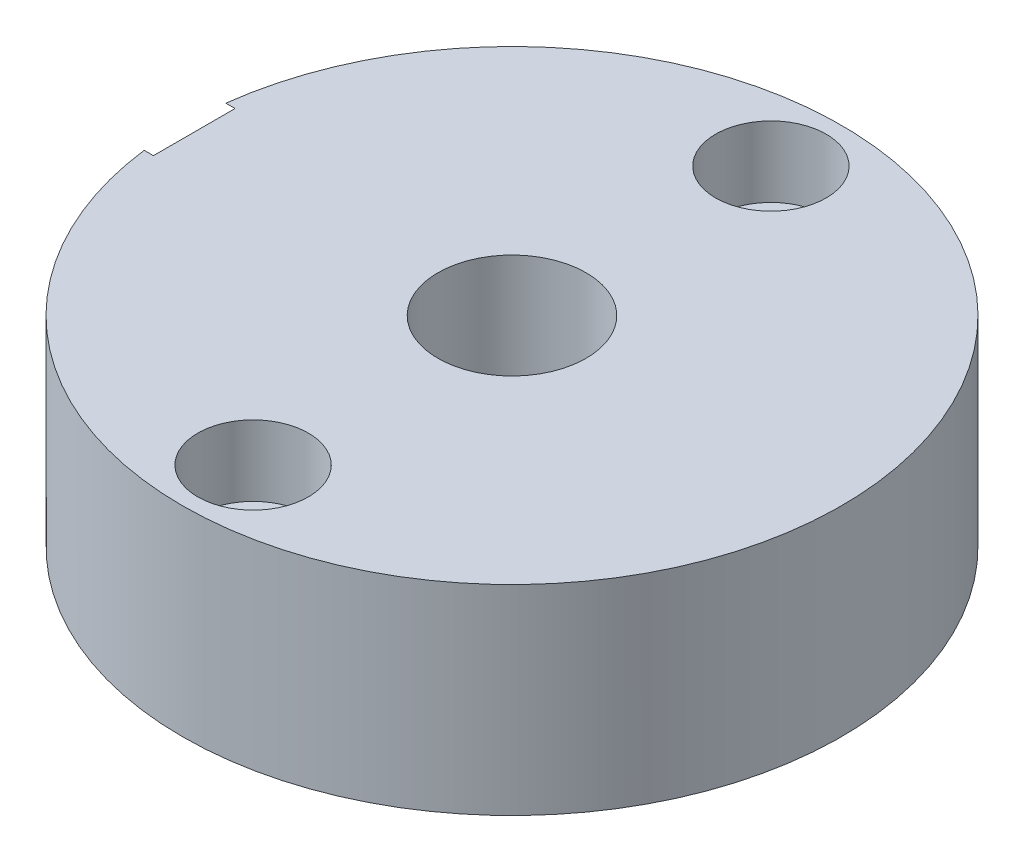
from build123d import *

# Parameters (mm, degrees)
SKETCH1_W                                          = 14.224
SKETCH1_H                                          = 8.636
CBORE_FOR_M2_5_HEX_HEAD_MACHINE_SCREW1_D           = 3.048
CBORE_FOR_M2_5_HEX_HEAD_MACHINE_SCREW1_CBORE_D     = 4.7752
CBORE_FOR_M2_5_HEX_HEAD_MACHINE_SCREW1_CBORE_DEPTH = 3.048
M2_5_CLEARANCE_HOLE1_D                             = 3.048
M2_5_CLEARANCE_HOLE1_DEPTH                         = 2.54
CBORE_FOR_M6_HEX_HEAD_BOLT1_D                      = 6.4008
CBORE_FOR_M6_HEX_HEAD_BOLT1_CBORE_D                = 15.494
CBORE_FOR_M6_HEX_HEAD_BOLT1_CBORE_DEPTH            = 2.54
CBORE_FOR_M3_5_HEX_HEAD_MACHINE_SCREW1_D           = 3.96748
CBORE_FOR_M3_5_HEX_HEAD_MACHINE_SCREW1_DEPTH       = 7.112
CBORE_FOR_M3_5_HEX_HEAD_MACHINE_SCREW1_CBORE_D     = 7.9375
CBORE_FOR_M3_5_HEX_HEAD_MACHINE_SCREW1_CBORE_DEPTH = 0.508
CBORE_FOR_M3_5_HEX_HEAD_MACHINE_SCREW1_TIP         = 1.145312823
CHAMFER1_SIZE                                      = 0.42926


with BuildPart() as part:
    # Sketch1 → Revolve1 (revolve)
    with BuildSketch(Plane(origin=(0, 0, 0), x_dir=(-1, 0, 0), z_dir=(0, 0, -1)), mode=Mode.PRIVATE) as revolve1_sk:
        with Locations((-7.112, 4.318)):
            Rectangle(SKETCH1_W, SKETCH1_H)
    revolve(revolve1_sk.sketch.rotate(Axis((0, 0, 0), (0, 1, 0)), 270), axis=Axis((0, 0, 0), (0, 1, 0)))

    # CBORE for M2.5 Hex Head Machine Screw1 (through all)
    with Locations(Plane(origin=(0, 8.636, 0), x_dir=(1, 0, 0), z_dir=(0, 1, 0))):
        with Locations((0, -11.176), (0, 11.176)):
            CounterBoreHole(CBORE_FOR_M2_5_HEX_HEAD_MACHINE_SCREW1_D / 2, CBORE_FOR_M2_5_HEX_HEAD_MACHINE_SCREW1_CBORE_D / 2, CBORE_FOR_M2_5_HEX_HEAD_MACHINE_SCREW1_CBORE_DEPTH)

    # M2.5 Clearance Hole1
    with Locations(Plane(origin=(0, 0, 0), x_dir=(-1, 0, 0), z_dir=(0, -1, 0))):
        with Locations((-7.902625387, 7.902625387), (7.902625387, -7.902625387), (-7.902625387, -7.902625387), (7.902625387, 7.902625387)):
            Hole(M2_5_CLEARANCE_HOLE1_D / 2, depth=M2_5_CLEARANCE_HOLE1_DEPTH)

    # CBORE for M6 Hex Head Bolt1 (through all)
    with Locations(Plane(origin=(0, 0, 0), x_dir=(-1, 0, 0), z_dir=(0, -1, 0))):
        with Locations((0, 0)):
            CounterBoreHole(CBORE_FOR_M6_HEX_HEAD_BOLT1_D / 2, CBORE_FOR_M6_HEX_HEAD_BOLT1_CBORE_D / 2, CBORE_FOR_M6_HEX_HEAD_BOLT1_CBORE_DEPTH)

    # CBORE for M3.5 Hex Head Machine Screw1
    with Locations(Plane(origin=(-14.224, 5.08, 0), x_dir=(0, 0, -1), z_dir=(-1, 0, 0))):
        with Locations((0, 0)):
            CounterBoreHole(CBORE_FOR_M3_5_HEX_HEAD_MACHINE_SCREW1_D / 2, CBORE_FOR_M3_5_HEX_HEAD_MACHINE_SCREW1_CBORE_D / 2, CBORE_FOR_M3_5_HEX_HEAD_MACHINE_SCREW1_CBORE_DEPTH, depth=CBORE_FOR_M3_5_HEX_HEAD_MACHINE_SCREW1_DEPTH)
            with Locations((0, 0, -(CBORE_FOR_M3_5_HEX_HEAD_MACHINE_SCREW1_DEPTH + CBORE_FOR_M3_5_HEX_HEAD_MACHINE_SCREW1_TIP / 2))):  # 120° drill point
                Cone(0, CBORE_FOR_M3_5_HEX_HEAD_MACHINE_SCREW1_D / 2, CBORE_FOR_M3_5_HEX_HEAD_MACHINE_SCREW1_TIP, mode=Mode.SUBTRACT)

    # Chamfer1
    chamfer1_edges = [part.edges().sort_by_distance(p)[0] for p in [
        (-13.716, 5.08, -1.98374),
    ]]
    chamfer(chamfer1_edges, length=CHAMFER1_SIZE)


solid = part.part
